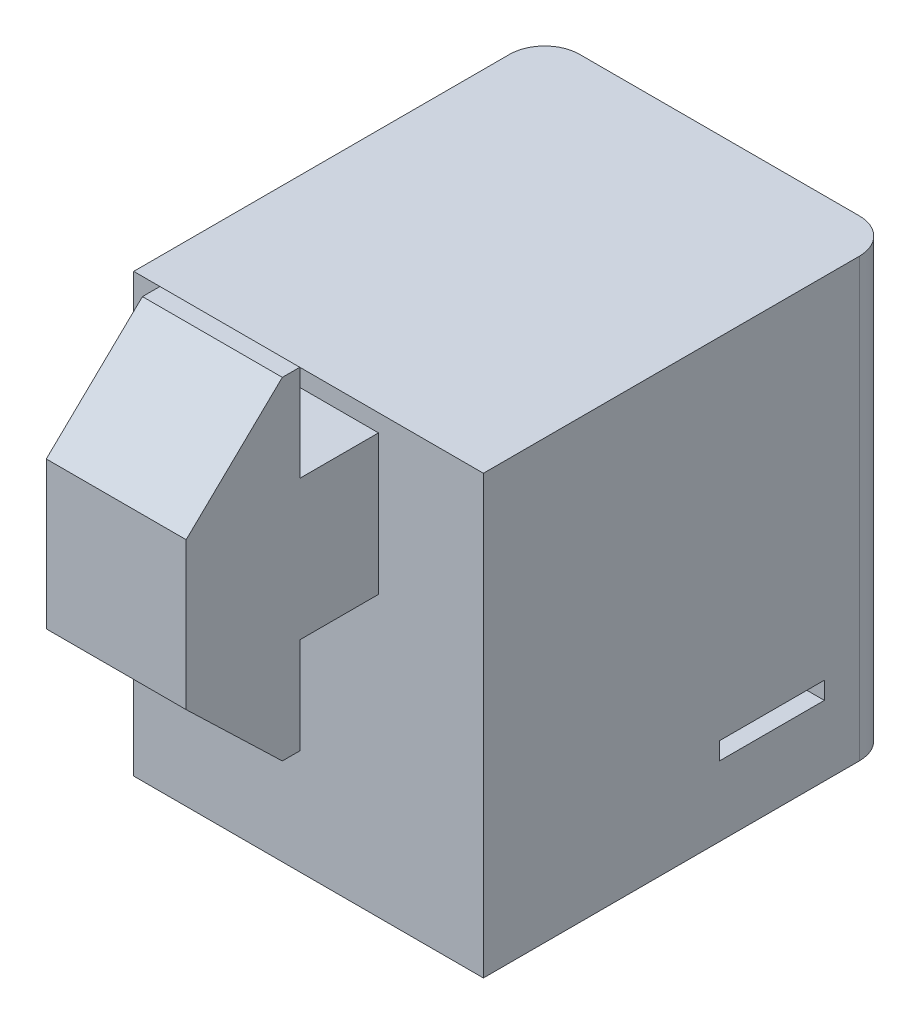
from build123d import *

# Parameters (mm, degrees)
ESTRUSIONE_ESTRUSIONE1_DEPTH = 8
SCHIZZO2_W                   = 14
SCHIZZO2_H                   = 5.5
ESTRUSIONE_ESTRUSIONE2_DEPTH = 9.208407085
SCHIZZO3_W                   = 6
SCHIZZO3_H                   = 5.5
ESTRUSIONE_ESTRUSIONE3_DEPTH = 5.291592915
SCHIZZO4_W                   = 14
SCHIZZO4_H                   = 14.5
ESTRUSIONE_ESTRUSIONE4_DEPTH = 5.5
ESTRUSIONE_ESTRUSIONE5_DEPTH = 4.5
TAGLIO_ESTRUSIONE1_DEPTH     = 8
TAGLIO_ESTRUSIONE2_DEPTH     = 5.5
SCHIZZO8_W                   = 14
SCHIZZO8_H                   = 19
ESTRUSIONE_ESTRUSIONE6_DEPTH = 23.5
ESTRUSIONE_ESTRUSIONE7_DEPTH = 10.5
TAGLIO_ESTRUSIONE3_DEPTH     = 4.5
TAGLIO_ESTRUSIONE4_DEPTH     = 1
TAGLIO_ESTRUSIONE5_DEPTH     = 4.5
SCHIZZO13_W                  = 23.5
SCHIZZO13_H                  = 25
ESTRUSIONE_ESTRUSIONE8_DEPTH = 6
SCHIZZO14_W                  = 6
SCHIZZO14_H                  = 1
TAGLIO_ESTRUSIONE6_DEPTH     = 5
TAGLIO_ESTRUSIONE7_DEPTH     = 14
SCHIZZO16_W                  = 6
SCHIZZO16_H                  = 1
TAGLIO_ESTRUSIONE8_DEPTH     = 5
RACCORDO1_R                  = 2


with BuildPart() as part:
    # Schizzo1 → Estrusione-Estrusione1 (new body)
    with BuildSketch(Plane(origin=(4, 0, 0), x_dir=(0, 0, -1), z_dir=(1, 0, 0))):
        Polygon((-5.5, -9.5), (-5.5, -4.208407085), (-11, -4.208407085), align=None)
    extrude(amount=-ESTRUSIONE_ESTRUSIONE1_DEPTH)

    # Schizzo2 → Estrusione-Estrusione2 (add)
    with BuildSketch(Plane(origin=(0, -4.208407085, 0), x_dir=(-1, 0, 0), z_dir=(0, 1, 0))):
        with Locations((3, 8.25)):
            Rectangle(SCHIZZO2_W, SCHIZZO2_H)
    extrude(amount=ESTRUSIONE_ESTRUSIONE2_DEPTH)

    # Schizzo3 → Estrusione-Estrusione3 (add)
    with BuildSketch(Plane.XZ.offset(4.208407085)):
        with Locations((-7, 8.25)):
            Rectangle(SCHIZZO3_W, SCHIZZO3_H)
    extrude(amount=ESTRUSIONE_ESTRUSIONE3_DEPTH)

    # Schizzo4 → Estrusione-Estrusione4 (add)
    with BuildSketch(Plane(origin=(0, 0, 5.5), x_dir=(-1, 0, 0), z_dir=(0, 9.448610433574674e-12, -1.0))):
        with Locations((3, -2.25)):
            Rectangle(SCHIZZO4_W, SCHIZZO4_H)
    extrude(amount=ESTRUSIONE_ESTRUSIONE4_DEPTH)

    # Schizzo5 → Estrusione-Estrusione5 (add)
    with BuildSketch(Plane(origin=(0, 5, 0), x_dir=(-1, 0, 0), z_dir=(0, 1, 0))):
        with BuildLine():
            Line((10, 0), (-4, 0))
            add(Edge.make_bspline(
                [(-4, 4.5), (-4, 3), (-4, 1.5), (-4, 0)],
                knots=[0, 0, 0, 0, 1, 1, 1, 1], degree=3))
            Line((-4, 4.5), (-4, 11))
            Line((-4, 11), (10, 11))
            add(Edge.make_bspline(
                [(10, 11), (10, 9.166666667), (10, 7.333333333), (10, 5.5)],
                knots=[0, 0, 0, 0, 1, 1, 1, 1], degree=3))
            add(Edge.make_bspline(
                [(10, 5.5), (10, 5.166666667), (10, 4.833333333), (10, 4.5)],
                knots=[0, 0, 0, 0, 1, 1, 1, 1], degree=3))
            add(Edge.make_bspline(
                [(10, 4.5), (10, 3), (10, 1.5), (10, 0)],
                knots=[0, 0, 0, 0, 1, 1, 1, 1], degree=3))
        make_face()
    extrude(amount=ESTRUSIONE_ESTRUSIONE5_DEPTH)

    # Schizzo6 → Taglio-Estrusione1 (cut)
    with BuildSketch(Plane(origin=(4, 0, 0), x_dir=(0, 0, -1), z_dir=(1, 0, 0))):
        Polygon((-11, 4.208407085), (-5.5, 9.5), (-11, 9.5), align=None)
    extrude(amount=-TAGLIO_ESTRUSIONE1_DEPTH, mode=Mode.SUBTRACT)

    # Schizzo7 → Taglio-Estrusione2 (cut)
    with BuildSketch(Plane.XY.offset(11)):
        with BuildLine():
            Line((-10, -9.5), (-4, -9.5))
            Line((-4, -9.5), (-4, 9.5))
            Line((-4, 9.5), (-10, 9.5))
            add(Edge.make_bspline(
                [(-10, 9.5), (-10, 8), (-10, 6.5), (-10, 5)],
                knots=[0, 0, 0, 0, 1, 1, 1, 1], degree=3))
            Line((-10, 5), (-10, -9.5))
        make_face()
    extrude(amount=-TAGLIO_ESTRUSIONE2_DEPTH, mode=Mode.SUBTRACT)

    # Schizzo8 → Estrusione-Estrusione6 (add)
    with BuildSketch(Plane(origin=(0, 0, 0), x_dir=(-1, 0, 0), z_dir=(0, 3.448151725834727e-12, -1.0))):
        with Locations((3, 0)):
            Rectangle(SCHIZZO8_W, SCHIZZO8_H)
    extrude(amount=ESTRUSIONE_ESTRUSIONE6_DEPTH)

    # Schizzo9 → Estrusione-Estrusione7 (add)
    with BuildSketch(Plane.XZ.offset(9.5)):
        with BuildLine():
            Line((4, -23.5), (-10, -23.5))
            Line((-10, -23.5), (-10, 0))
            add(Edge.make_bspline(
                [(-10, 4.5), (-10, 3), (-10, 1.5), (-10, 0)],
                knots=[0, 0, 0, 0, 1, 1, 1, 1], degree=3))
            add(Edge.make_bspline(
                [(-10, 5.5), (-10, 5.166666667), (-10, 4.833333333), (-10, 4.5)],
                knots=[0, 0, 0, 0, 1, 1, 1, 1], degree=3))
            Line((-10, 5.5), (4, 5.5))
            add(Edge.make_bspline(
                [(4, 5.5), (4, 5.166666667), (4, 4.833333333), (4, 4.5)],
                knots=[0, 0, 0, 0, 1, 1, 1, 1], degree=3))
            add(Edge.make_bspline(
                [(4, 4.5), (4, 3), (4, 1.5), (4, 0)],
                knots=[0, 0, 0, 0, 1, 1, 1, 1], degree=3))
            Line((4, 0), (4, -23.5))
        make_face()
    extrude(amount=ESTRUSIONE_ESTRUSIONE7_DEPTH)

    # Schizzo10 → Taglio-Estrusione3 (cut)
    with BuildSketch(Plane(origin=(0, 9.5, 0), x_dir=(-1, 0, 0), z_dir=(0, 1, 0))):
        with BuildLine():
            Line((10, -23.5), (10, 0))
            add(Edge.make_bspline(
                [(10, 4.5), (10, 3), (10, 1.5), (10, 0)],
                knots=[0, 0, 0, 0, 1, 1, 1, 1], degree=3))
            add(Edge.make_bspline(
                [(10, 5.5), (10, 5.166666667), (10, 4.833333333), (10, 4.5)],
                knots=[0, 0, 0, 0, 1, 1, 1, 1], degree=3))
            Line((10, 5.5), (4, 5.5))
            Line((4, 5.5), (4, 4.5))
            Line((4, 4.5), (-4, 4.5))
            add(Edge.make_bspline(
                [(-4, 4.5), (-4, 3), (-4, 1.5), (-4, 0)],
                knots=[0, 0, 0, 0, 1, 1, 1, 1], degree=3))
            Line((-4, 0), (-4, -23.5))
            Line((-4, -23.5), (10, -23.5))
        make_face()
    extrude(amount=-TAGLIO_ESTRUSIONE3_DEPTH, mode=Mode.SUBTRACT)

    # Schizzo11 → Taglio-Estrusione4 (cut)
    with BuildSketch(Plane.XY.offset(5.5)):
        Polygon((-4, -9.5), (-4, 5), (-10, 5), (-10, -20), (4, -20), (4, -9.5), align=None)
    extrude(amount=-TAGLIO_ESTRUSIONE4_DEPTH, mode=Mode.SUBTRACT)

    # Schizzo12 → Taglio-Estrusione5 (cut)
    with BuildSketch(Plane.XY.offset(4.5)):
        Polygon((4, 4), (4, 5), (-10, 5), (-10, -20), (4, -20), (4, -4), (-4, -4), (-4, 4), align=None)
    extrude(amount=-TAGLIO_ESTRUSIONE5_DEPTH, mode=Mode.SUBTRACT)

    # Schizzo13 → Estrusione-Estrusione8 (add)
    with BuildSketch(Plane(origin=(4, 0, 0), x_dir=(0, 0, -1), z_dir=(1, 0, 0))):
        with Locations((11.75, -7.5)):
            Rectangle(SCHIZZO13_W, SCHIZZO13_H)
    extrude(amount=ESTRUSIONE_ESTRUSIONE8_DEPTH)

    # Schizzo14 → Taglio-Estrusione6 (cut)
    with BuildSketch(Plane.ZY.offset(10)):
        with Locations((-16.5, -15.5)):
            Rectangle(SCHIZZO14_W, SCHIZZO14_H)
    extrude(amount=-TAGLIO_ESTRUSIONE6_DEPTH, mode=Mode.SUBTRACT)

    # Schizzo15 → Taglio-Estrusione7 (cut)
    with BuildSketch(Plane.XZ.offset(20)):
        with BuildLine():
            Line((3.1, -11.9000249), (3.1, -8.0999751))
            ThreePointArc((3.1, -8.0999751), (0, -4.9999751), (-3.1, -8.0999751))
            Line((-3.1, -8.0999751), (-3.1, -11.9000249))
            ThreePointArc((-3.1, -11.9000249), (0, -15.0000249), (3.1, -11.9000249))
        make_face()
    extrude(amount=-TAGLIO_ESTRUSIONE7_DEPTH, mode=Mode.SUBTRACT)

    # Schizzo16 → Taglio-Estrusione8 (cut)
    with BuildSketch(Plane(origin=(10, 0, 0), x_dir=(0, 0, -1), z_dir=(1, 0, 0))):
        with Locations((16.5, -15.5)):
            Rectangle(SCHIZZO16_W, SCHIZZO16_H)
    extrude(amount=-TAGLIO_ESTRUSIONE8_DEPTH, mode=Mode.SUBTRACT)

    # Raccordo1
    raccordo1_edges = [part.edges().sort_by_distance(p)[0] for p in [
        (-10, -2.25, -23.5),
        (10, -7.5, -23.5),
    ]]
    fillet(raccordo1_edges, radius=RACCORDO1_R)


solid = part.part
